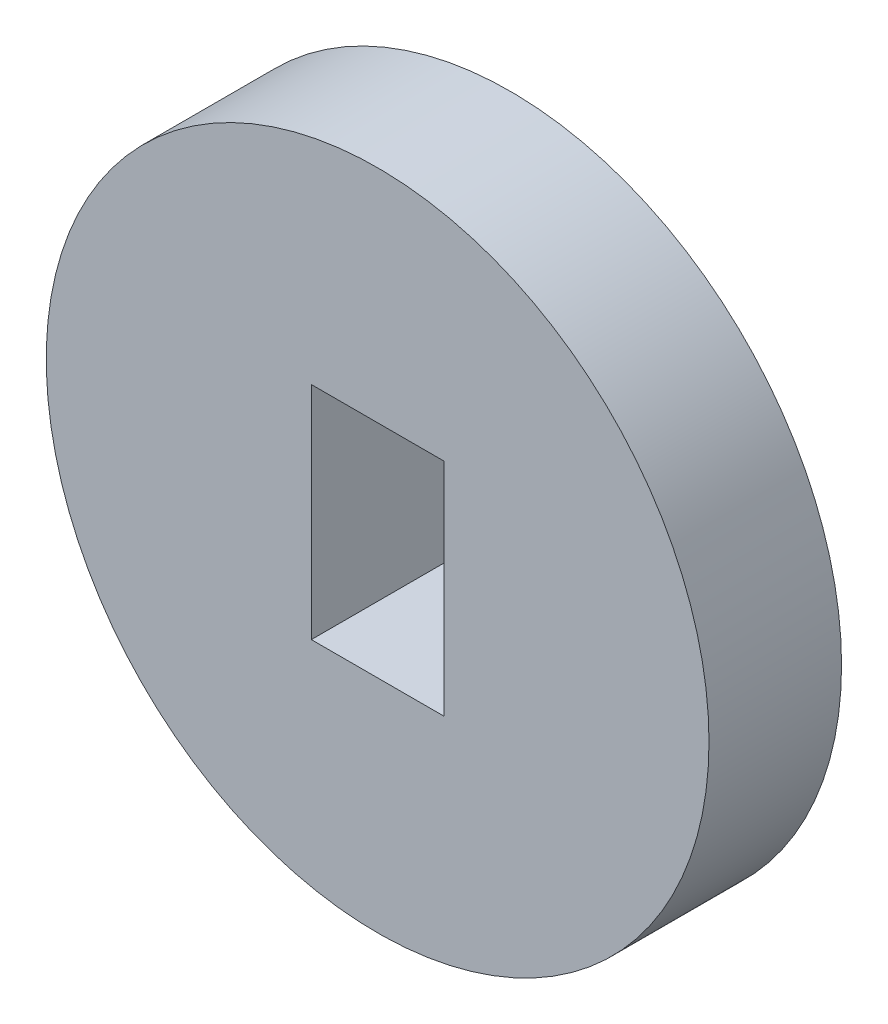
from build123d import *

# Parameters (mm, degrees)
ESBO_O1_R                = 15
RESSALTO_EXTRUS_O1_DEPTH = 6
ESBO_O2_W                = 6
ESBO_O2_H                = 10
CORTE_EXTRUS_O1_DEPTH    = 6


with BuildPart() as part:
    # Esboço1 → Ressalto-extrusão1 (new body)
    with BuildSketch(Plane.XY):
        Circle(ESBO_O1_R)
    extrude(amount=RESSALTO_EXTRUS_O1_DEPTH)

    # Esboço2 → Corte-extrusão1 (cut)
    with BuildSketch(Plane.XY.offset(6)):
        Rectangle(ESBO_O2_W, ESBO_O2_H)
    extrude(amount=-CORTE_EXTRUS_O1_DEPTH, mode=Mode.SUBTRACT)


solid = part.part
